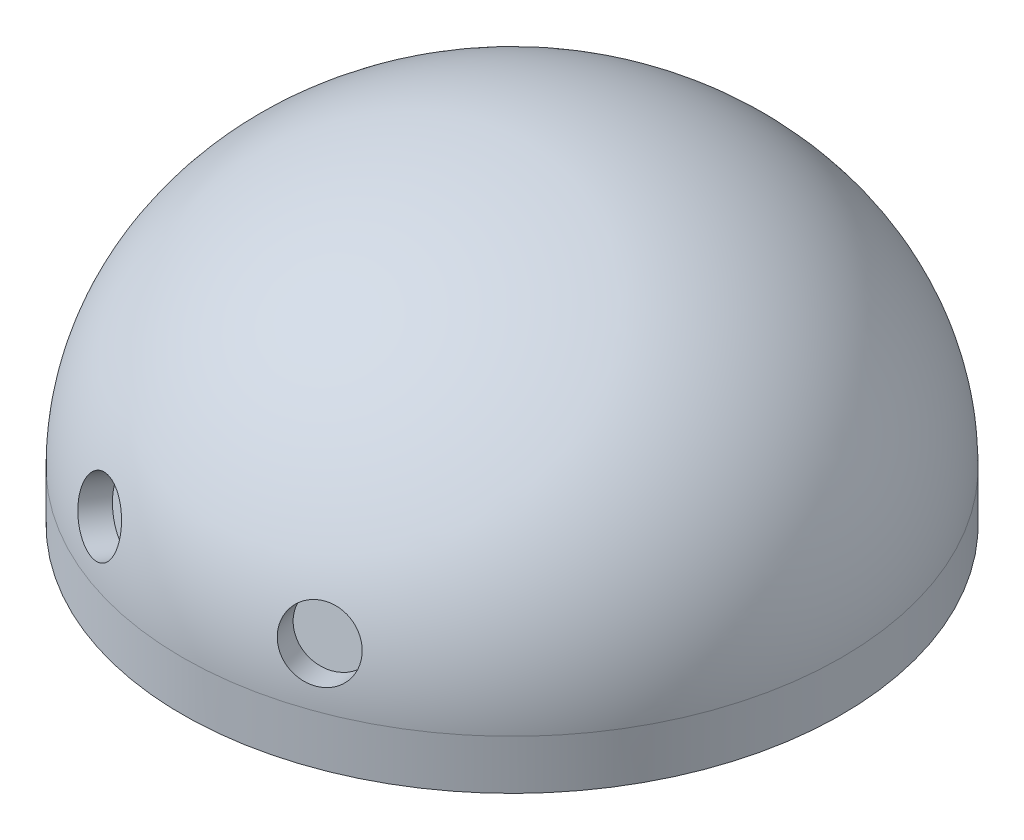
from build123d import *

# Parameters (mm, degrees)
ESBO_O5_R                = 20
EXTENS_O_DA_CABE_A_DEPTH = 3
ESBO_O23_R               = 2
FURO_DO_OLHO_DEPTH       = 5


with BuildPart() as part:
    # Esboço4 → Casca da Cabeça (revolve)
    with BuildSketch(Plane.XY):
        with BuildLine():
            Line((0, 17), (0, 0))
            Line((0, 0), (20, 0))
            add(Edge.make_bspline(
                [(20, 0), (20, 17), (0, 17)],
                knots=[3.141592654, 3.141592654, 3.141592654, 4.71238898, 4.71238898, 4.71238898], degree=2, weights=[1, 0.707106781, 1]))
        make_face()
    revolve(axis=Axis((0, 26.677356491, 0), (0, -1, 0)))

    # Esboço5 → Extensão da Cabeça (add)
    with BuildSketch(Plane.XZ):
        with Locations(Location((0, 0, 0), (0, 0, 270))):
            Circle(ESBO_O5_R)
    extrude(amount=EXTENS_O_DA_CABE_A_DEPTH)

    # Esboço23 → Furo do Olho (cut)
    with BuildSketch(Plane(origin=(7.820148998, 3.788505574, 21.485682788), x_dir=(-0.9413543124097008, 0.058592317187180776, 0.3322935432329316), z_dir=(-0.33741970675652505, -0.1634644608888513, -0.9270530251925495))):
        with Locations(Location((0, 0, 0), (0, 0, 176.595132679))):
            Circle(ESBO_O23_R)
    furo_do_olho = extrude(amount=FURO_DO_OLHO_DEPTH, mode=Mode.SUBTRACT)

    # Face Esquerda (Espelhar): Furo do Olho across plane
    add(furo_do_olho.mirror(Plane(origin=(0, 0, 0), x_dir=(0, 0, 1), z_dir=(1, 0, 0))), mode=Mode.SUBTRACT)


solid = part.part
